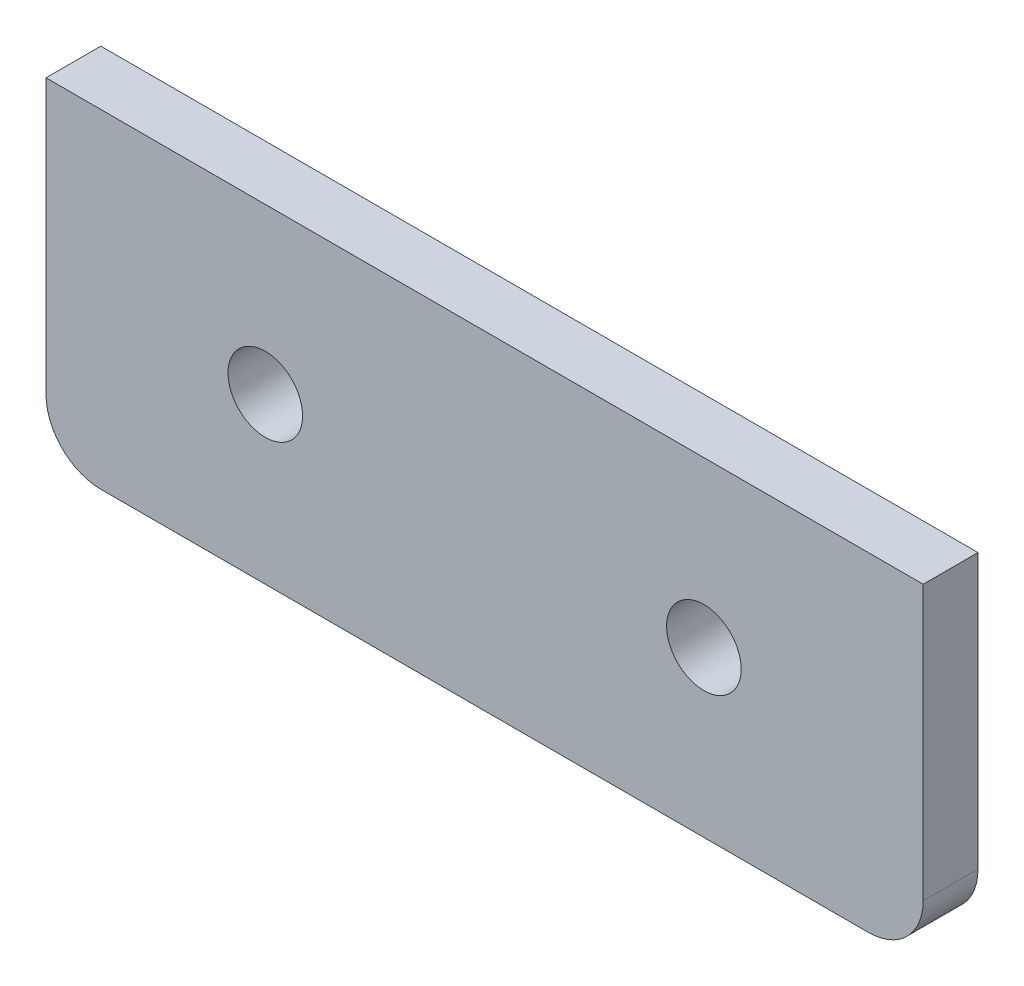
from build123d import *

# Parameters (mm, degrees)
IZIM1_W                     = 80
IZIM1_H                     = 30
Y_KSEKLIK_EKSTR_ZYON1_DEPTH = 5
RADYUS2_R                   = 5
IZIM2_R                     = 3.4
KES_EKSTR_ZYON1_DEPTH       = 8


with BuildPart() as part:
    # Çizim1 → Yükseklik-Ekstrüzyon1 (new body)
    with BuildSketch(Plane.XY):
        Rectangle(IZIM1_W, IZIM1_H)
    extrude(amount=Y_KSEKLIK_EKSTR_ZYON1_DEPTH)

    # Radyus2
    radyus2_edges = [part.edges().sort_by_distance(p)[0] for p in [
        (40, -15, 2.5),
        (-40, -15, 2.5),
    ]]
    fillet(radyus2_edges, radius=RADYUS2_R)

    # Çizim2 → Kes-Ekstrüzyon1 (cut)
    with BuildSketch(Plane.XY.offset(5)):
        with Locations((-20, 0)):
            Circle(IZIM2_R)
        with Locations((20, 0)):
            Circle(IZIM2_R)
    extrude(amount=-KES_EKSTR_ZYON1_DEPTH, mode=Mode.SUBTRACT)


solid = part.part
